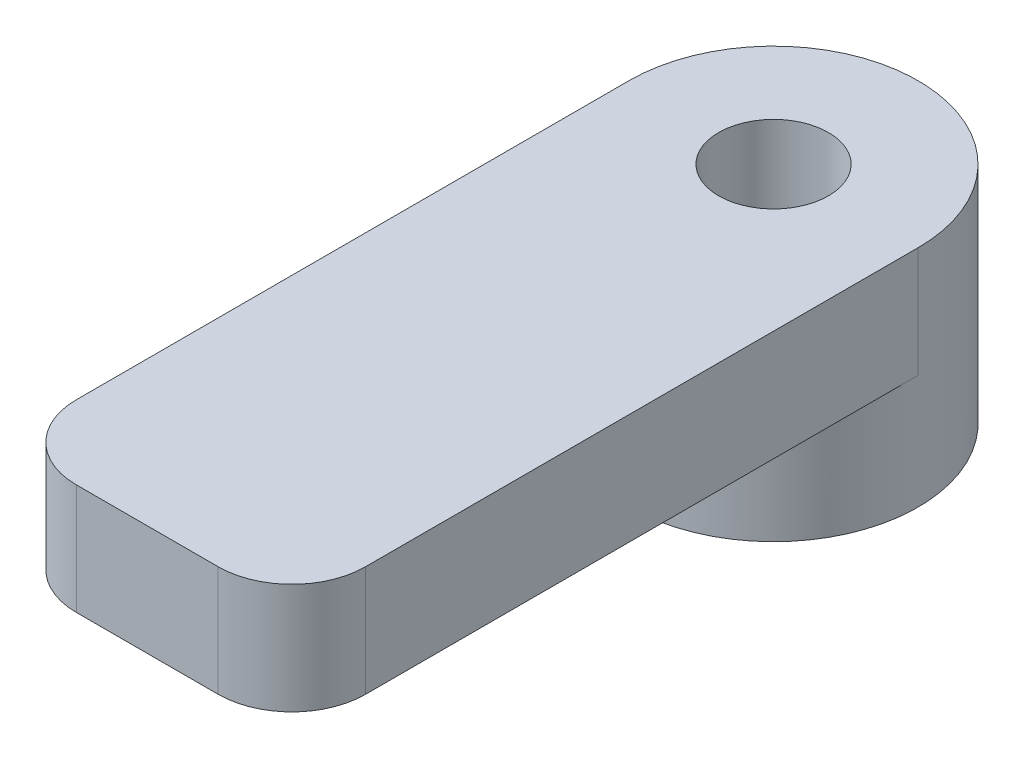
from build123d import *

# Parameters (mm, degrees)
SKETCH1_R           = 3.925
BOSS_EXTRUDE1_DEPTH = 3.1
SKETCH2_R           = 1.49
CUT_EXTRUDE1_DEPTH  = 3.1
SKETCH3_R           = 1.49
BOSS_EXTRUDE2_DEPTH = 3


with BuildPart() as part:
    # Sketch1 → Boss-Extrude1 (new body)
    with BuildSketch(Plane(origin=(0, 0, 0), x_dir=(1, 0, 0), z_dir=(0, 1, 0))):
        with Locations(Location((0, 0, 0), (0, 0, 90))):
            Circle(SKETCH1_R)
    extrude(amount=BOSS_EXTRUDE1_DEPTH)

    # Sketch2 → Cut-Extrude1 (cut)
    with BuildSketch(Plane(origin=(0, 3.1, 0), x_dir=(1, 0, 0), z_dir=(0, 1, 0))):
        with Locations(Location((0, 0, 0), (0, 0, 270))):
            Circle(SKETCH2_R)
    extrude(amount=-CUT_EXTRUDE1_DEPTH, mode=Mode.SUBTRACT)

    # Sketch3 → Boss-Extrude2 (add)
    with BuildSketch(Plane(origin=(0, 3.1, 0), x_dir=(1, 0, 0), z_dir=(0, 1, 0))):
        with BuildLine():
            Line((-3.925, 0), (-3.925, -15))
            ThreePointArc((-3.925, -15), (-3.339213562, -16.414213562), (-1.925, -17))
            Line((-1.925, -17), (1.925, -17))
            ThreePointArc((1.925, -17), (3.339213562, -16.414213562), (3.925, -15))
            Line((3.925, -15), (3.925, 0))
            ThreePointArc((3.925, 0), (0, 3.925), (-3.925, 0))
        make_face()
        with Locations(Location((0, 0, 0), (0, 0, 270))):
            Circle(SKETCH3_R, mode=Mode.SUBTRACT)
    extrude(amount=BOSS_EXTRUDE2_DEPTH)


solid = part.part
